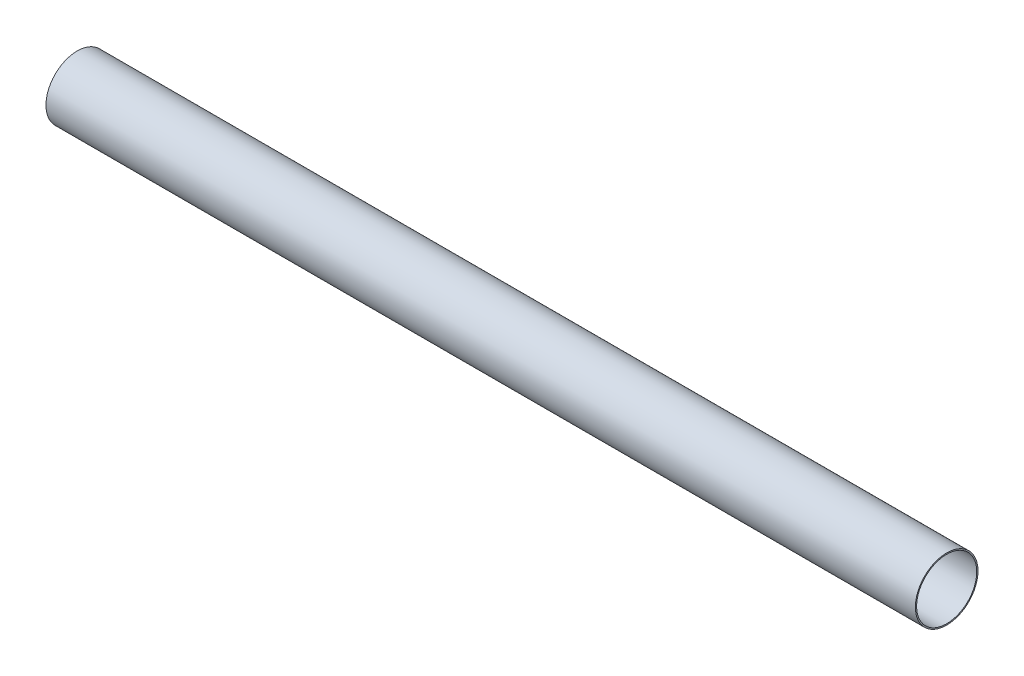
from build123d import *

# Parameters (mm, degrees)
SKETCH1_W = 1101.725
SKETCH1_H = 1.5875


with BuildPart() as part:
    # Sketch1 → Revolve1 (revolve)
    with BuildSketch(Plane(origin=(0, 0, 0), x_dir=(1, 0, 0), z_dir=(0, 1, 0))):
        with Locations((550.8625, 38.89375)):
            Rectangle(SKETCH1_W, SKETCH1_H)
    revolve(axis=Axis((0, 0, 0), (-1, 0, 0)))


solid = part.part
